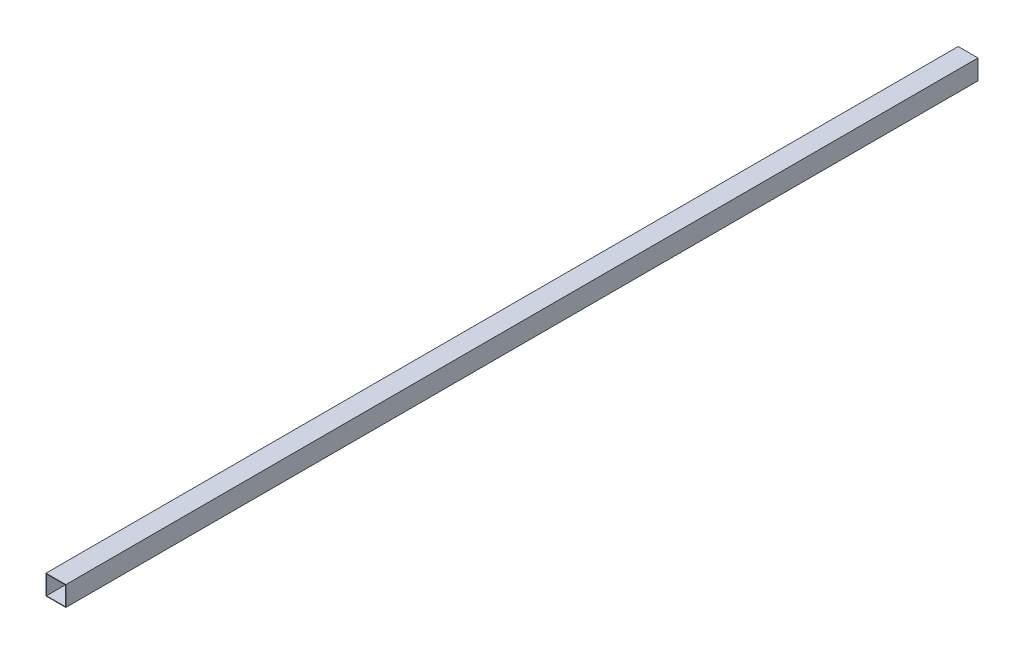
from build123d import *

# Parameters (mm, degrees)
SKETCH_1_W      = 40
SKETCH_1_H      = 40
SKETCH_1_W_2    = 38
SKETCH_1_H_2    = 38
EXTRUDE_1_DEPTH = 1840


with BuildPart() as part:
    # 草图1 → 凸台-拉伸1 (new body)
    with BuildSketch(Plane.XY):
        with Locations((20, 20)):
            Rectangle(SKETCH_1_W, SKETCH_1_H)
        with Locations((20, 20)):
            Rectangle(SKETCH_1_W_2, SKETCH_1_H_2, mode=Mode.SUBTRACT)
    extrude(amount=EXTRUDE_1_DEPTH)


solid = part.part
